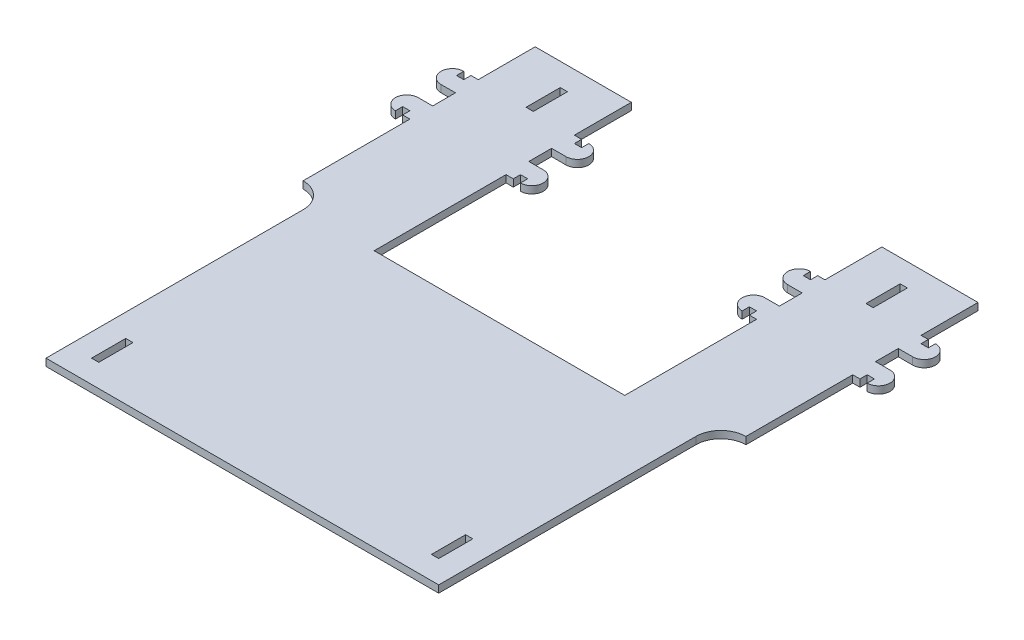
from build123d import *

# Parameters (mm, degrees)
SKETCH1_W           = 3.175
SKETCH1_H           = 15
BOSS_EXTRUDE1_DEPTH = 3.175


with BuildPart() as part:
    # Sketch1 → Boss-Extrude1 (new body)
    with BuildSketch(Plane(origin=(0, 0, 0), x_dir=(1, 0, 0), z_dir=(0, 1, 0))):
        with BuildLine():
            Line((-55, 0), (55, 0))
            Line((55, 0), (55, 57.88))
            Line((55, 57.88), (51.825, 57.88))
            Line((51.825, 57.88), (51.825, 61.055))
            Line((51.825, 61.055), (48.65, 61.055))
            Line((48.65, 61.055), (48.65, 57.88))
            ThreePointArc((48.65, 57.88), (43.65, 62.88), (48.65, 67.88))
            Line((48.65, 67.88), (55, 67.88))
            Line((55, 67.88), (55, 77.88))
            Line((55, 77.88), (48.65, 77.88))
            ThreePointArc((48.65, 77.88), (43.65, 82.88), (48.65, 87.88))
            Line((48.65, 87.88), (48.65, 84.705))
            Line((48.65, 84.705), (51.825, 84.705))
            Line((51.825, 84.705), (51.825, 87.88))
            Line((51.825, 87.88), (55, 87.88))
            Line((55, 87.88), (55, 112.88))
            Line((55, 112.88), (76.2, 112.88))
            Line((76.2, 112.88), (86.2, 112.88))
            Line((86.2, 112.88), (97.2, 112.88))
            Line((97.2, 112.88), (97.2, 87.88))
            Line((97.2, 87.88), (100.375, 87.88))
            Line((100.375, 87.88), (100.375, 84.705))
            Line((100.375, 84.705), (103.55, 84.705))
            Line((103.55, 84.705), (103.55, 87.88))
            ThreePointArc((103.55, 87.88), (108.55, 82.88), (103.55, 77.88))
            Line((103.55, 77.88), (97.2, 77.88))
            Line((97.2, 77.88), (97.2, 67.88))
            Line((97.2, 67.88), (103.55, 67.88))
            ThreePointArc((103.55, 67.88), (108.55, 62.88), (103.55, 57.88))
            Line((103.55, 57.88), (103.55, 61.055))
            Line((103.55, 61.055), (100.375, 61.055))
            Line((100.375, 61.055), (100.375, 57.88))
            Line((100.375, 57.88), (97.2, 57.88))
            Line((97.2, 57.88), (97.2, 11))
            ThreePointArc((97.2, 11), (89.421825407, 7.778174593), (86.2, 0))
            Line((86.2, 0), (86.2, -102.88))
            Line((86.2, -102.88), (86.2, -112.88))
            Line((86.2, -112.88), (76.2, -112.88))
            Line((76.2, -112.88), (-76.2, -112.88))
            Line((-76.2, -112.88), (-86.2, -112.88))
            Line((-86.2, -112.88), (-86.2, -102.88))
            Line((-86.2, -102.88), (-86.2, 0))
            ThreePointArc((-86.2, 0), (-89.421825407, 7.778174593), (-97.2, 11))
            Line((-97.2, 11), (-97.2, 57.88))
            Line((-97.2, 57.88), (-100.375, 57.88))
            Line((-100.375, 57.88), (-100.375, 61.055))
            Line((-100.375, 61.055), (-103.55, 61.055))
            Line((-103.55, 61.055), (-103.55, 57.88))
            ThreePointArc((-103.55, 57.88), (-108.55, 62.88), (-103.55, 67.88))
            Line((-103.55, 67.88), (-97.2, 67.88))
            Line((-97.2, 67.88), (-97.2, 77.88))
            Line((-97.2, 77.88), (-103.55, 77.88))
            ThreePointArc((-103.55, 77.88), (-108.55, 82.88), (-103.55, 87.88))
            Line((-103.55, 87.88), (-103.55, 84.705))
            Line((-103.55, 84.705), (-100.375, 84.705))
            Line((-100.375, 84.705), (-100.375, 87.88))
            Line((-100.375, 87.88), (-97.2, 87.88))
            Line((-97.2, 87.88), (-97.2, 112.88))
            Line((-97.2, 112.88), (-86.2, 112.88))
            Line((-86.2, 112.88), (-76.2, 112.88))
            Line((-76.2, 112.88), (-55, 112.88))
            Line((-55, 112.88), (-55, 87.88))
            Line((-55, 87.88), (-51.825, 87.88))
            Line((-51.825, 87.88), (-51.825, 84.705))
            Line((-51.825, 84.705), (-48.65, 84.705))
            Line((-48.65, 84.705), (-48.65, 87.88))
            ThreePointArc((-48.65, 87.88), (-43.65, 82.88), (-48.65, 77.88))
            Line((-48.65, 77.88), (-55, 77.88))
            Line((-55, 77.88), (-55, 67.88))
            Line((-55, 67.88), (-48.65, 67.88))
            ThreePointArc((-48.65, 67.88), (-43.65, 62.88), (-48.65, 57.88))
            Line((-48.65, 57.88), (-48.65, 61.055))
            Line((-48.65, 61.055), (-51.825, 61.055))
            Line((-51.825, 61.055), (-51.825, 57.88))
            Line((-51.825, 57.88), (-55, 57.88))
            Line((-55, 57.88), (-55, 0))
        make_face()
        with Locations((74.6125, 95.38)):
            Rectangle(SKETCH1_W, SKETCH1_H, mode=Mode.SUBTRACT)
        with Locations((-74.6125, 95.38)):
            Rectangle(SKETCH1_W, SKETCH1_H, mode=Mode.SUBTRACT)
        with Locations((-74.6125, -95.38)):
            Rectangle(SKETCH1_W, SKETCH1_H, mode=Mode.SUBTRACT)
        with Locations((74.6125, -95.38)):
            Rectangle(SKETCH1_W, SKETCH1_H, mode=Mode.SUBTRACT)
    extrude(amount=BOSS_EXTRUDE1_DEPTH)


solid = part.part
